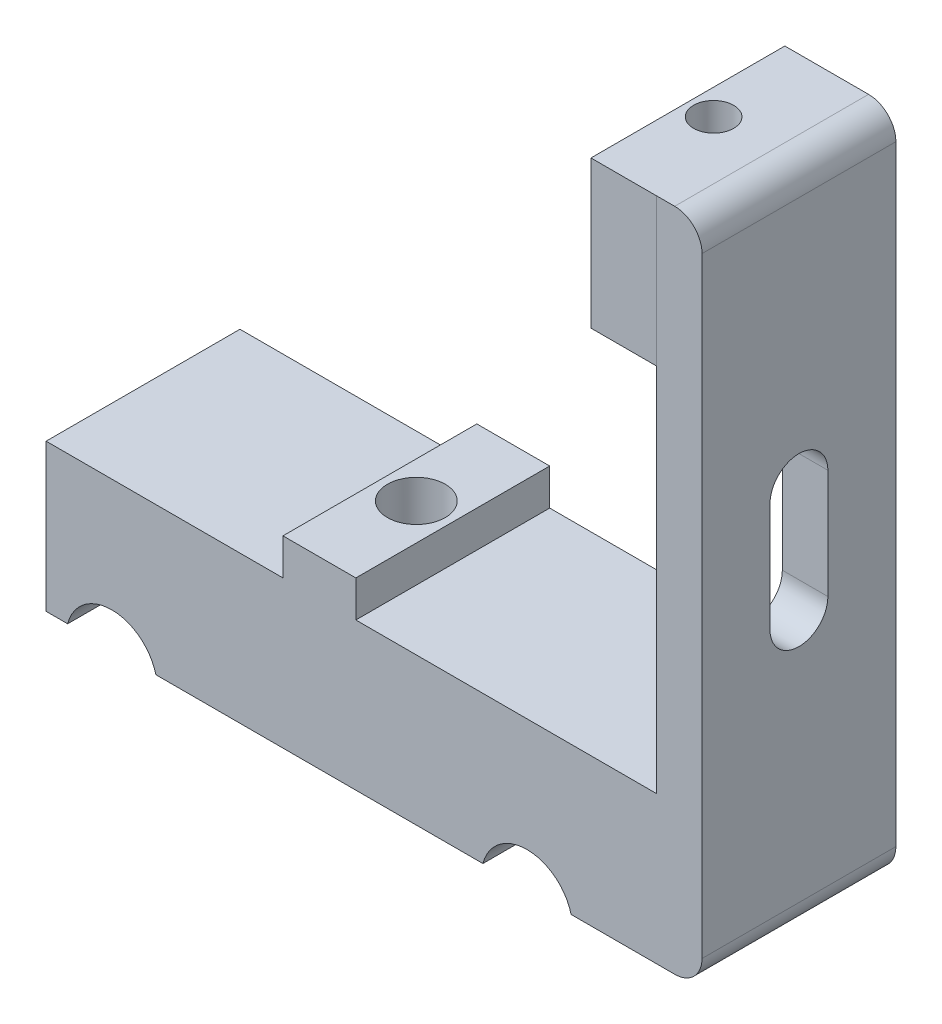
from build123d import *

# Parameters (mm, degrees)
BOSS_EXTRUDE1_DEPTH     = 10.8
BOSS_EXTRUDE2_DEPTH     = 10.64
CUT_EXTRUDE1_DEPTH      = 39.168054705
CUT_EXTRUDE1_DEPTH_BACK = 39.168054705
SKETCH5_R               = 5
FILLET1_R               = 1
SKETCH6_W               = 21.28
SKETCH6_H               = 16.18
BOSS_EXTRUDE3_DEPTH     = 12
SKETCH7_W               = 5
SKETCH7_H               = 21.281328743
BOSS_EXTRUDE4_DEPTH     = 56.83
SKETCH8_W               = 21.284331222
SKETCH8_H               = 16.18
BOSS_EXTRUDE5_DEPTH     = 7.19
FILLET3_R               = 3
SKETCH9_R               = 2.2
CUT_EXTRUDE2_DEPTH      = 85.918196519
SKETCH10_R              = 3.175
CUT_EXTRUDE3_DEPTH      = 85.918196519
SKETCH11_W              = 24.977296572
SKETCH11_H              = 9.721484234
CUT_EXTRUDE4_DEPTH      = 71.220021919
CUT_EXTRUDE6_DEPTH      = 90.46728118


with BuildPart() as part:
    # Sketch2 → Boss-Extrude1 (new body)
    with BuildSketch(Plane.XY):
        Polygon((-10.1, 0), (0, 0), (0, 7), (-6.25480432, 7), (-10.1, 1.709943763), align=None)
        Polygon((0, 0), (10.1, 0), (10.1, 1.709943763), (6.25480432, 7), (0, 7), align=None)
    extrude(amount=BOSS_EXTRUDE1_DEPTH)

    # Sketch4 → Boss-Extrude2 (add, symmetric)
    with BuildSketch(Plane.XY):
        Polygon((-4, 0), (-4, -4.8), (-30, -4.8), (-30, -20.98), (30, -20.98), (30, -4.8), (4, -4.8), (4, 0), align=None)
    extrude(amount=BOSS_EXTRUDE2_DEPTH, both=True)

    # Sketch5 → Cut-Extrude1 (cut, two sides: drawn at the far end of the back side and taken through both)
    with BuildSketch(Plane.XY.offset(-CUT_EXTRUDE1_DEPTH_BACK)):
        with Locations((-22.790976064, -22.227391232)):
            Circle(SKETCH5_R)
        with Locations((22.790976064, -22.227391232)):
            Circle(SKETCH5_R)
    extrude(amount=CUT_EXTRUDE1_DEPTH + CUT_EXTRUDE1_DEPTH_BACK, mode=Mode.SUBTRACT)

    # Fillet1
    fillet1_edges = [part.edges().sort_by_distance(p)[0] for p in [
        (-10.1, 0, 5.4),
        (-10.1, 1.709943763, 5.4),
        (-6.25480432, 7, 5.4),
        (6.25480432, 7, 5.4),
        (10.1, 1.709943763, 5.4),
        (10.1, 0, 5.4),
    ]]
    fillet(fillet1_edges, radius=FILLET1_R)

    # Sketch6 → Boss-Extrude3 (add)
    with BuildSketch(Plane(origin=(30, 0, 0), x_dir=(0, 0, -1), z_dir=(1, 0, 0))):
        with Locations((0, -12.89)):
            Rectangle(SKETCH6_W, SKETCH6_H)
    extrude(amount=BOSS_EXTRUDE3_DEPTH)

    # Sketch7 → Boss-Extrude4 (add)
    with BuildSketch(Plane(origin=(0, -4.8, 0), x_dir=(1, 0, 0), z_dir=(0, 1, 0))):
        with Locations((39.5, 0.000664372)):
            Rectangle(SKETCH7_W, SKETCH7_H)
    extrude(amount=BOSS_EXTRUDE4_DEPTH)

    # Sketch8 → Boss-Extrude5 (add)
    with BuildSketch(Plane.ZY.offset(-37)):
        with Locations((0.000836868, 43.94)):
            Rectangle(SKETCH8_W, SKETCH8_H)
    extrude(amount=BOSS_EXTRUDE5_DEPTH)

    # Fillet3
    fillet3_edges = [part.edges().sort_by_distance(p)[0] for p in [
        (42, -20.98, 0),
        (42, 52.03, -0.000664372),
    ]]
    fillet(fillet3_edges, radius=FILLET3_R)

    # Sketch9 → Cut-Extrude2 (cut, through all)
    with BuildSketch(Plane.XZ.offset(20.98)):
        with Locations((32.632878078, 0)):
            Circle(SKETCH9_R)
    extrude(amount=-CUT_EXTRUDE2_DEPTH, mode=Mode.SUBTRACT)

    # Sketch10 → Cut-Extrude3 (cut, through all)
    with BuildSketch(Plane.XZ.offset(20.98)):
        with Locations((0.000925951, 0)):
            Circle(SKETCH10_R)
    extrude(amount=-CUT_EXTRUDE3_DEPTH, mode=Mode.SUBTRACT)

    # Sketch11 → Cut-Extrude4 (cut, through all)
    with BuildSketch(Plane.XY.offset(10.8)):
        with Locations((-0.121132817, 4.060742117)):
            Rectangle(SKETCH11_W, SKETCH11_H)
    extrude(amount=-CUT_EXTRUDE4_DEPTH, mode=Mode.SUBTRACT)

    # Sketch13 → Cut-Extrude6 (cut, through all)
    with BuildSketch(Plane(origin=(42, 0, 0), x_dir=(0, 0, -1), z_dir=(1, 0, 0))):
        with BuildLine():
            Line((3.175, 21.525), (3.175, 9.525))
            ThreePointArc((3.175, 9.525), (0, 6.35), (-3.175, 9.525))
            Line((-3.175, 9.525), (-3.175, 21.525))
            ThreePointArc((-3.175, 21.525), (0, 24.7), (3.175, 21.525))
        make_face()
    extrude(amount=-CUT_EXTRUDE6_DEPTH, mode=Mode.SUBTRACT)


solid = part.part
